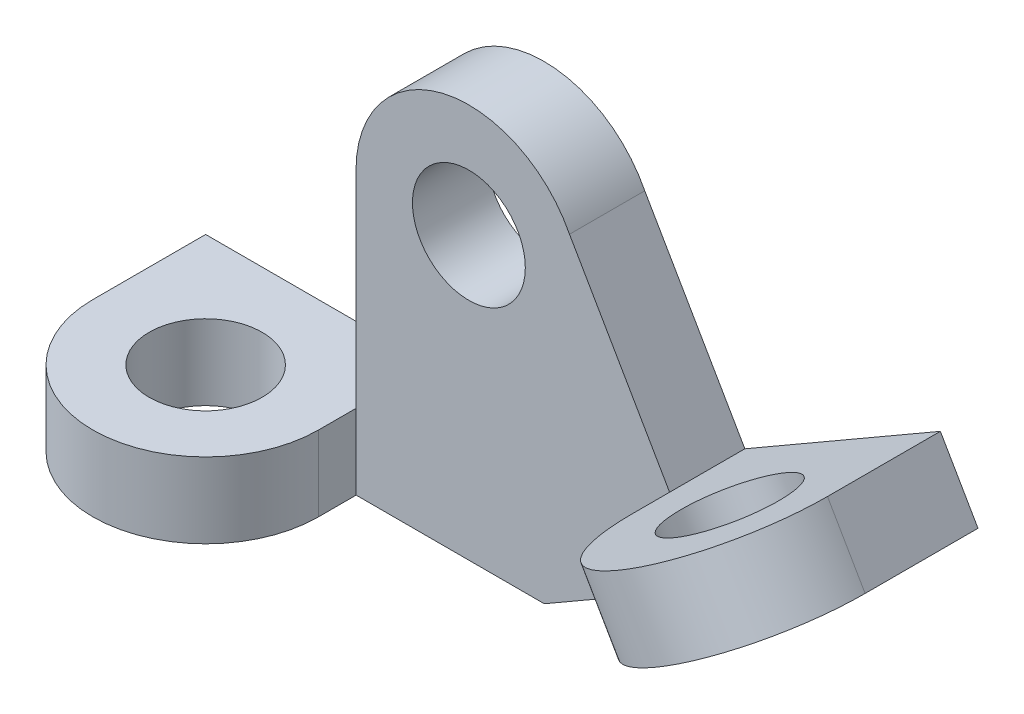
from build123d import *

# Parameters (mm, degrees)
SKETCH1_W             = 150
SKETCH1_H             = 50
BOSS_EXTRUDE2_DEPTH   = 150
BOSS_EXTRUDE2_2_DEPTH = 150
SKETCH1_4_R           = 37.5
SKETCH1_4_W           = 150
SKETCH1_4_H           = 50
BOSS_EXTRUDE3_DEPTH   = 50
FILLET2_RADIUS        = 75
FILLET2_LENGTH        = 50
FILLET3_RADIUS        = 75
FILLET3_LENGTH        = 50
SKETCH2_R             = 37.5
CUT_EXTRUDE1_DEPTH    = 576.129630886
SKETCH3_R             = 37.5
CUT_EXTRUDE2_DEPTH    = 598.441520826


with BuildPart() as part:
    # Sketch1 → Boss-Extrude2 (new body)
    with BuildSketch(Plane.XY):
        with Locations((75, 25)):
            Rectangle(SKETCH1_W, SKETCH1_H)
    extrude(amount=BOSS_EXTRUDE2_DEPTH)



with BuildPart() as body_2:
    # Sketch1 → Boss-Extrude2 2 (new body)
    with BuildSketch(Plane.XY):
        Polygon((358.253175473, 105.801270189), (383.253175473, 62.5), (513.156986041, 137.5), (488.156986041, 180.801270189), align=None)
    extrude(amount=BOSS_EXTRUDE2_2_DEPTH)


with BuildPart() as part_1:
    add(part.part)

    add(body_2.part)  # Boss-Extrude3 merges body 2
    # Sketch1<4> → Boss-Extrude3 (add)
    # profile 1 of 3: a face of its own
    with BuildSketch(Plane.XY):
        with BuildLine():
            Line((150, 50), (150, 0))
            Line((150, 0), (275, 0))
            Line((275, 0), (383.253175473, 62.5))
            Line((383.253175473, 62.5), (358.253175473, 105.801270189))
            Line((358.253175473, 105.801270189), (291.750893275, 220.986601776))
            ThreePointArc((291.750893275, 220.986601776), (207.419297449, 259.935945937), (149.893501015, 187))
            Line((149.893501015, 187), (149.89359166, 186.883395343))
            Line((149.89359166, 186.883395343), (150, 50))
        make_face()
        with Locations((224.893501015, 187)):
            Circle(SKETCH1_4_R, mode=Mode.SUBTRACT)
    # profile 2 of 3: a face of its own
    with BuildSketch(Plane.XY):
        with Locations((75, 25)):
            Rectangle(SKETCH1_4_W, SKETCH1_4_H)
    # profile 3 of 3: a face of its own
    with BuildSketch(Plane.XY):
        Polygon((358.253175473, 105.801270189), (383.253175473, 62.5), (513.156986041, 137.5), (488.156986041, 180.801270189), align=None)
    extrude(amount=BOSS_EXTRUDE3_DEPTH)

    # Fillet2: full round fillet: the end face becomes a half cylinder, R = half its width
    fillet2_face = Plane((435.705080757, 121.650635095, 150), x_dir=(0.5, -0.866025403784, 0), z_dir=(0, 0, 1))  # on the end face: x along it, z out of the body
    fillet2_slab = fillet2_face.offset(-FILLET2_RADIUS / 2) * Box(FILLET2_LENGTH, 2 * FILLET2_RADIUS, FILLET2_RADIUS, mode=Mode.PRIVATE)  # the body's end, R deep
    fillet2_round = Plane((435.705080757, 121.650635095, 75), x_dir=(0, 0, 1), z_dir=(0.5, -0.866025403784, 0)) * Cylinder(FILLET2_RADIUS, FILLET2_LENGTH, mode=Mode.PRIVATE)  # its axis R under the face
    add(fillet2_slab - fillet2_round, mode=Mode.SUBTRACT)

    # Fillet3: full round fillet: the end face becomes a half cylinder, R = half its width
    fillet3_face = Plane((75, 25, 150), x_dir=(0, -1, 0), z_dir=(0, 0, 1))  # on the end face: x along it, z out of the body
    fillet3_slab = fillet3_face.offset(-FILLET3_RADIUS / 2) * Box(FILLET3_LENGTH, 2 * FILLET3_RADIUS, FILLET3_RADIUS, mode=Mode.PRIVATE)  # the body's end, R deep
    fillet3_round = Plane((75, 25, 75), x_dir=(0, 0, 1), z_dir=(0, -1, 0)) * Cylinder(FILLET3_RADIUS, FILLET3_LENGTH, mode=Mode.PRIVATE)  # its axis R under the face
    add(fillet3_slab - fillet3_round, mode=Mode.SUBTRACT)

    # Sketch2 → Cut-Extrude1 (cut, through all)
    with BuildSketch(Plane(origin=(0, 50, 0), x_dir=(1, 0, 0), z_dir=(0, 1, 0))):
        with Locations(Location((75, -75, 0), (0, 0, 270))):
            Circle(SKETCH2_R)
    extrude(amount=-CUT_EXTRUDE1_DEPTH, mode=Mode.SUBTRACT)

    # Sketch3 → Cut-Extrude2 (cut, through all)
    with BuildSketch(Plane(origin=(43.75, -75.777222831, 0), x_dir=(0.8660254037844382, 0.500000000000001, 0), z_dir=(-0.500000000000001, 0.8660254037844382, 0))):
        with Locations(Location((438.156986041, -75, 0), (0, 0, 180))):
            Circle(SKETCH3_R)
    extrude(amount=-CUT_EXTRUDE2_DEPTH, mode=Mode.SUBTRACT)


solid = part_1.part
